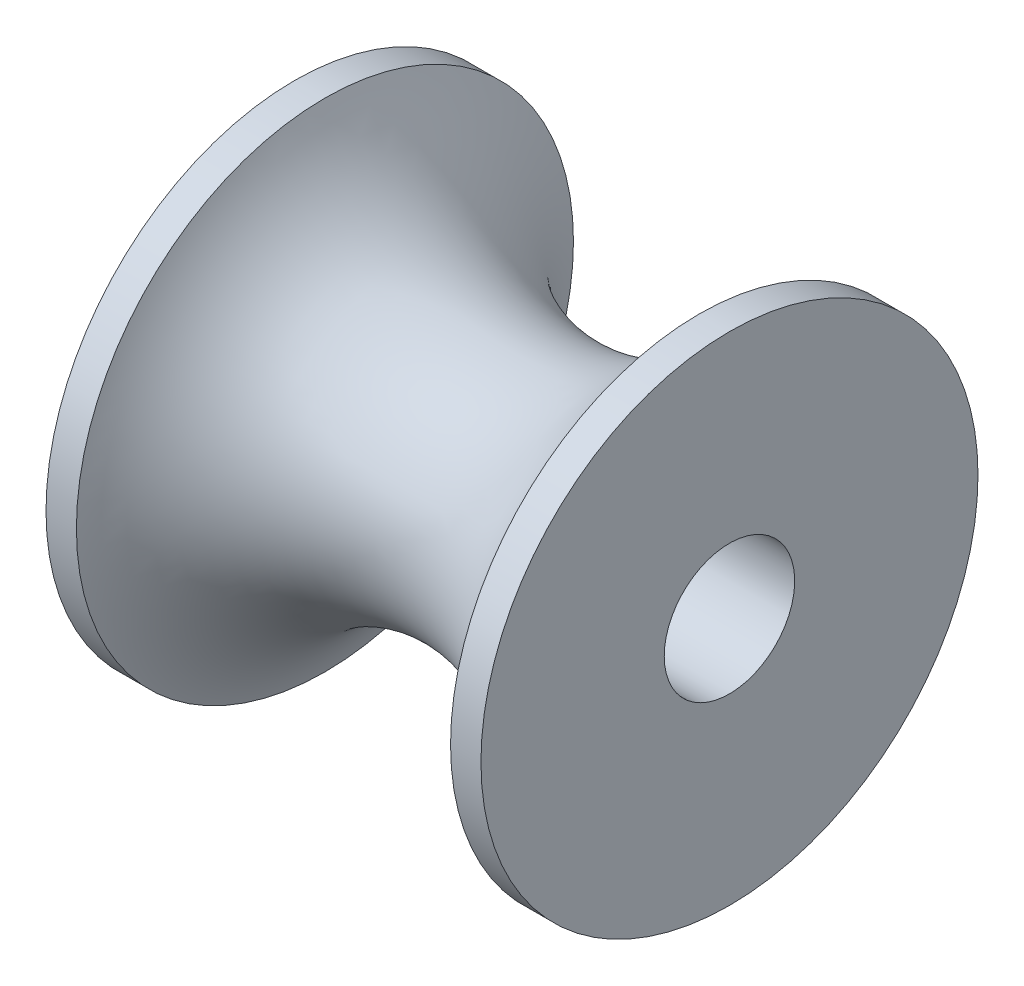
from build123d import *

# Parameters (mm, degrees)
SKETCH3_R          = 2.1
CUT_EXTRUDE1_DEPTH = 19


with BuildPart() as part:
    # Sketch2 → Revolve2 (revolve)
    with BuildSketch(Plane(origin=(0, 0, 0), x_dir=(1, 0, 0), z_dir=(0, 1, 0)), mode=Mode.PRIVATE) as revolve2_sk:
        with BuildLine():
            Line((0, 0), (14, 0))
            Line((14, 0), (14, 8))
            Line((14, 8), (13.021433052, 8))
            ThreePointArc((13.021433052, 8), (7, 3.94792647), (0.978566948, 8))
            Line((0.978566948, 8), (0, 8))
            Line((0, 8), (0, 0))
        make_face()
    revolve(revolve2_sk.sketch.rotate(Axis((0, 0, 0), (1, 0, 0)), 180), axis=Axis((0, 0, 0), (1, 0, 0)))

    # Sketch3 → Cut-Extrude1 (cut, through all)
    with BuildSketch(Plane.ZY):
        Circle(SKETCH3_R)
    extrude(amount=-CUT_EXTRUDE1_DEPTH, mode=Mode.SUBTRACT)


solid = part.part
